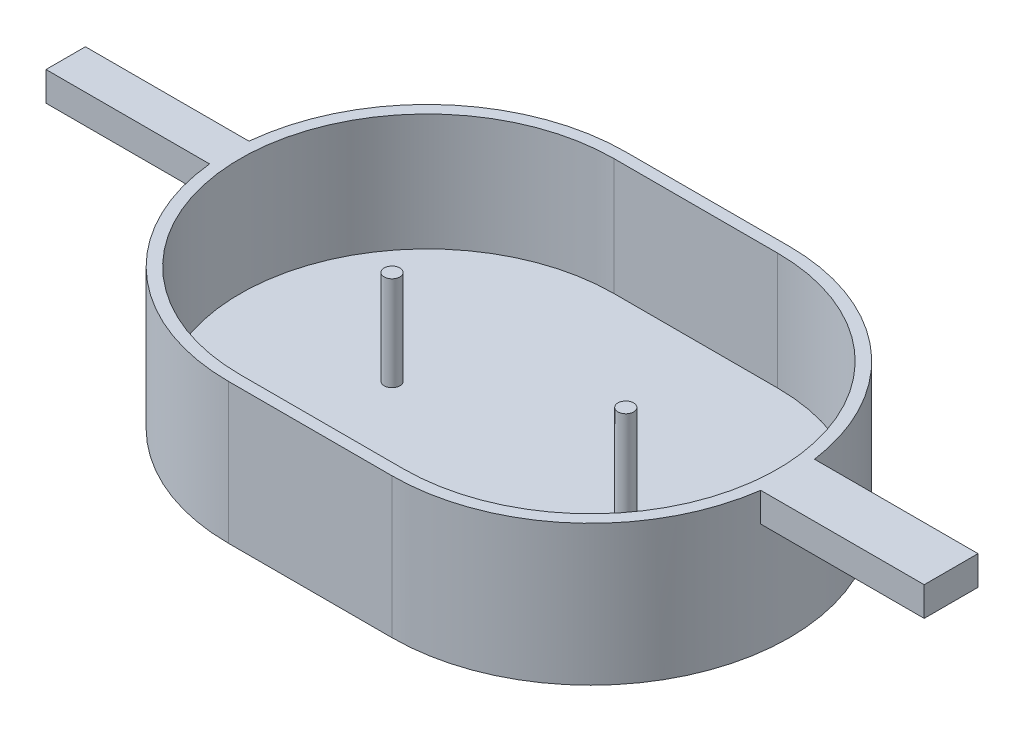
from build123d import *

# Parameters (mm, degrees)
BOSS_EXTRUDE1_DEPTH = 25.4
BOSS_EXTRUDE2_START = -30.48
BOSS_EXTRUDE2_DEPTH = 5.08
SKETCH4_R           = 1.7018
BOSS_EXTRUDE3_DEPTH = 20.4964
BOSS_EXTRUDE4_START = -6.35
BOSS_EXTRUDE4_DEPTH = 6.35


with BuildPart() as part:
    # Sketch1 → Boss-Extrude1 (new body)
    with BuildSketch(Plane(origin=(0, 0, 0), x_dir=(1, 0, 0), z_dir=(0, 1, 0))):
        with BuildLine():
            Line((0, 43.18), (35.56, 43.18))
            ThreePointArc((35.56, 43.18), (78.74, 0), (35.56, -43.18))
            Line((35.56, -43.18), (0, -43.18))
            ThreePointArc((0, -43.18), (-43.18, 0), (0, 43.18))
        make_face()
        with BuildLine():
            Line((0, 40.64), (35.56, 40.64))
            ThreePointArc((35.56, 40.64), (76.2, 0), (35.56, -40.64))
            Line((35.56, -40.64), (0, -40.64))
            ThreePointArc((0, -40.64), (-40.64, 0), (0, 40.64))
        make_face(mode=Mode.SUBTRACT)
    extrude(amount=BOSS_EXTRUDE1_DEPTH)

    # Sketch3 → Boss-Extrude2 (add)
    with BuildSketch(Plane(origin=(0, 25.4, 0), x_dir=(1, 0, 0), z_dir=(0, 1, 0)).offset(BOSS_EXTRUDE2_START)):
        with BuildLine():
            Line((0, 43.18), (35.56, 43.18))
            ThreePointArc((35.56, 43.18), (78.74, 0), (35.56, -43.18))
            Line((35.56, -43.18), (0, -43.18))
            ThreePointArc((0, -43.18), (-43.18, 0), (0, 43.18))
        make_face()
    extrude(amount=BOSS_EXTRUDE2_DEPTH)

    # Sketch4 → Boss-Extrude3 (add)
    with BuildSketch(Plane(origin=(0, 0, 0), x_dir=(1, 0, 0), z_dir=(0, 1, 0))):
        with Locations(Location((43.18, 0, 0), (0, 0, 270))):
            Circle(SKETCH4_R)
        with Locations(Location((-7.62, 0, 0), (0, 0, 270))):
            Circle(SKETCH4_R)
    extrude(amount=BOSS_EXTRUDE3_DEPTH)

    # Sketch5 → Boss-Extrude4 (add)
    with BuildSketch(Plane(origin=(0, 25.4, 0), x_dir=(1, 0, 0), z_dir=(0, 1, 0)).offset(BOSS_EXTRUDE4_START)):
        with BuildLine():
            Line((-40.416376905, 4.257473181), (-78.516376905, 4.257473181))
            Line((-78.516376905, 4.257473181), (-78.516376905, -4.307631169))
            Line((-78.516376905, -4.307631169), (-40.411061774, -4.307631169))
            ThreePointArc((-40.411061774, -4.307631169), (-40.639992175, -0.025219409), (-40.416376905, 4.257473181))
        make_face()
        with BuildLine():
            Line((75.777132348, 5.847381095), (113.877132348, 5.847381095))
            Line((113.877132348, 5.847381095), (113.877132348, -5.847381095))
            Line((113.877132348, -5.847381095), (75.777132348, -5.847381095))
            ThreePointArc((75.777132348, -5.847381095), (76.2, 0), (75.777132348, 5.847381095))
        make_face()
    extrude(amount=BOSS_EXTRUDE4_DEPTH)


solid = part.part
